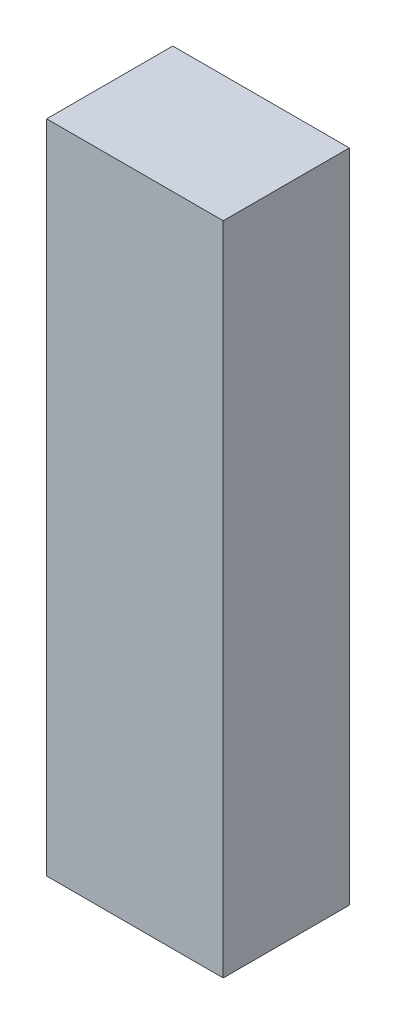
from build123d import *

# Parameters (mm, degrees)
SKETCH_1_W      = 14
SKETCH_1_H      = 52
EXTRUDE_1_DEPTH = 10


with BuildPart() as part:
    # 草图1 → 凸台-拉伸1 (new body)
    with BuildSketch(Plane.XY):
        Rectangle(SKETCH_1_W, SKETCH_1_H)
    extrude(amount=-EXTRUDE_1_DEPTH)


solid = part.part
